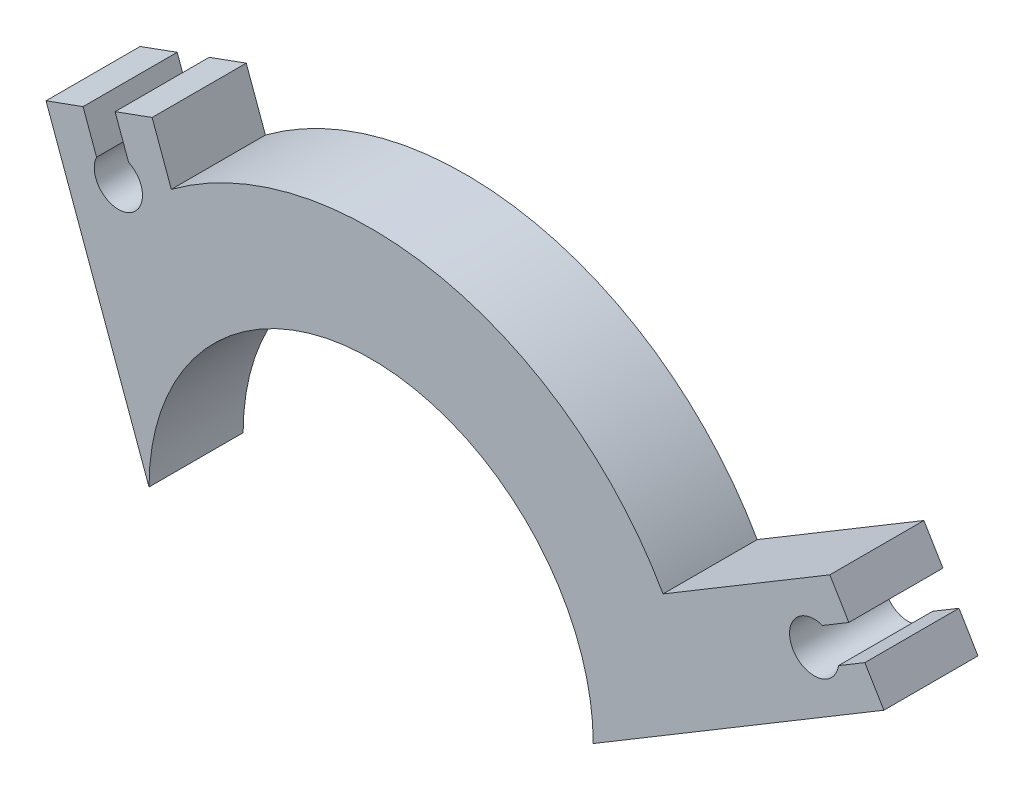
from build123d import *

# Parameters (mm, degrees)
BOSS_EXTRUDE1_DEPTH = 1.5875


with BuildPart() as part:
    # Sketch2 → Boss-Extrude1 (new body)
    with BuildSketch(Plane.XY):
        with BuildLine():
            Line((-3.7465, 0), (-5.483962328, 4.773638514))
            Line((-5.483962328, 4.773638514), (-4.85894288, 5.001126989))
            Line((-4.85894288, 5.001126989), (-4.631454405, 4.37610754))
            ThreePointArc((-4.631454405, 4.37610754), (-4.124133934, 3.822464398), (-4.091378859, 4.572678963))
            Line((-4.091378859, 4.572678963), (-4.318867334, 5.197698412))
            Line((-4.318867334, 5.197698412), (-3.693847885, 5.425186887))
            Line((-3.693847885, 5.425186887), (-3.370394701, 4.536506565))
            ThreePointArc((-3.370394701, 4.536506565), (1.174628372, 5.52808289), (4.923786313, 2.774126996))
            Line((4.923786313, 2.774126996), (7.736674427, 4.459657279))
            Line((7.736674427, 4.459657279), (8.057589571, 3.924099773))
            Line((8.057589571, 3.924099773), (7.612727117, 3.657530643))
            ThreePointArc((7.612727117, 3.657530643), (7.116813389, 3.053887496), (7.882987176, 3.206508602))
            Line((7.882987176, 3.206508602), (8.32784963, 3.473077733))
            Line((8.32784963, 3.473077733), (8.648764774, 2.937520227))
            Line((8.648764774, 2.937520227), (3.7465, 0))
            ThreePointArc((3.7465, 0), (0, 3.7465), (-3.7465, 0))
        make_face()
    extrude(amount=BOSS_EXTRUDE1_DEPTH)


solid = part.part
